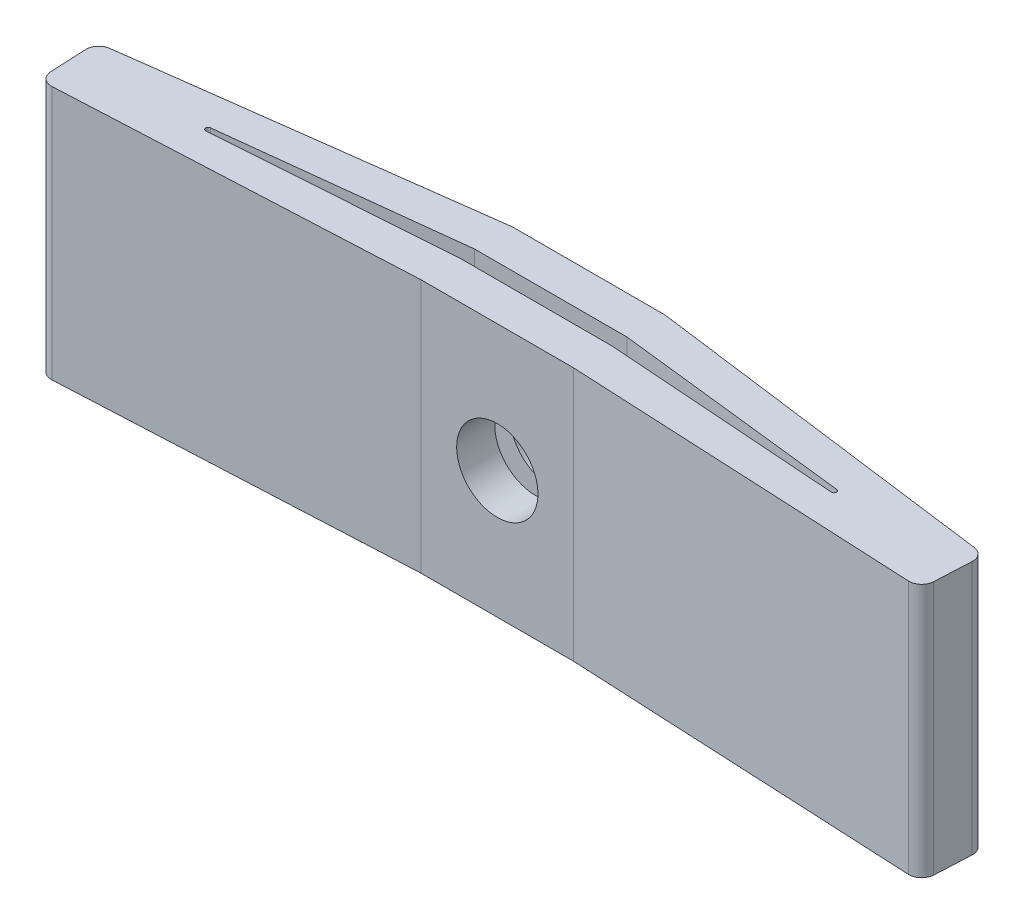
from build123d import *

# Parameters (mm, degrees)
BOSS_EXTRUDE1_DEPTH       = 10
FILLET1_R                 = 0.1
FILLET2_R                 = 0.5
SKETCH2_R                 = 1.6
CUT_EXTRUDE1_DEPTH        = 37.455365189
REVISION_INDICATION_DEPTH = 0.4


with BuildPart() as part:
    # Sketch1 → Boss-Extrude1 (new body)
    with BuildSketch(Plane(origin=(0, 0, 0), x_dir=(1, 0, 0), z_dir=(0, 1, 0))):
        Polygon((20.35, 0.7), (14.35, 0.7), (0, 0), (-0.117073171, 2.4), (14.35, 4.3), (20.35, 4.3), (34.817073171, 2.4), (34.7, 0), align=None)
        Polygon((20.35, 2.2), (14.35, 2.2), (0.35, 1.2), (14.35, 2.8), (20.35, 2.8), (34.35, 1.2), align=None, mode=Mode.SUBTRACT)
    extrude(amount=BOSS_EXTRUDE1_DEPTH)

    # Fillet1
    fillet1_edges = [part.edges().sort_by_distance(p)[0] for p in [
        (0.35, 5, -1.2),
        (34.35, 5, -1.2),
    ]]
    fillet(fillet1_edges, radius=FILLET1_R)

    # Fillet2
    fillet2_edges = [part.edges().sort_by_distance(p)[0] for p in [
        (-0.117073171, 5, -2.4),
        (34.817073171, 5, -2.4),
        (34.7, 5, 0),
        (0, 5, 0),
    ]]
    fillet(fillet2_edges, radius=FILLET2_R)

    # Sketch2 → Cut-Extrude1 (cut, through all)
    with BuildSketch(Plane(origin=(0, 0, -4.3), x_dir=(-1, 0, 0), z_dir=(0, 0, -1))):
        with Locations((-17.35, 5)):
            Circle(SKETCH2_R)
    extrude(amount=-CUT_EXTRUDE1_DEPTH, mode=Mode.SUBTRACT)

    # Sketch5 → revision indication (add)
    with BuildSketch(Plane(origin=(-0.311839138, 0, -2.374420857), x_dir=(-0.9914858429395939, 0, 0.13021452780071538), z_dir=(-0.13021452780071538, 0, -0.9914858429395939))):
        with BuildLine():
            add(Edge.make_bspline(
                [(-1.75614285, 1.976923077), (-1.720782037, 1.974821832), (-1.651461296, 1.970702586), (-1.551241734, 1.942442049), (-1.460537137, 1.892261337), (-1.379742922, 1.825381725), (-1.313146886, 1.744291021), (-1.261177847, 1.654309873), (-1.233163488, 1.553251269), (-1.229074248, 1.483528859), (-1.226976184, 1.44775641)],
                knots=[0, 0, 0, 0, 1.020151414, 1.999887582, 2.974338812, 3.990962822, 5.007586832, 5.987933904, 6.967670073, 8, 8, 8, 8], degree=3))
            add(Edge.make_bspline(
                [(-1.226976184, 1.44775641), (-1.229145345, 1.412843512), (-1.233422899, 1.343995789), (-1.261113631, 1.243699421), (-1.313542951, 1.153662038), (-1.379283581, 1.071471016), (-1.46055711, 1.004449722), (-1.551456175, 0.954695939), (-1.651226029, 0.924411918), (-1.720742787, 0.920554208), (-1.75614285, 0.918589744)],
                knots=[0, 0, 0, 0, 1.009421747, 1.99056486, 2.972319754, 3.999869655, 5.017953583, 5.993804169, 6.978383603, 8, 8, 8, 8], degree=3))
            add(Edge.make_bspline(
                [(-1.75614285, 0.918589744), (-1.791568422, 0.920483127), (-1.860728417, 0.924179507), (-1.960125864, 0.955317742), (-2.051578507, 1.003983162), (-2.132836213, 1.071595984), (-2.19912744, 1.153239101), (-2.249247777, 1.244319503), (-2.279347047, 1.343708683), (-2.283305588, 1.412786963), (-2.285309517, 1.44775641)],
                knots=[0, 0, 0, 0, 1.022052826, 1.995314843, 2.982371812, 4.00089066, 5.028879526, 6.005146991, 6.990147033, 8, 8, 8, 8], degree=3))
            add(Edge.make_bspline(
                [(-2.285309517, 1.44775641), (-2.283382565, 1.483587428), (-2.279620429, 1.553543092), (-2.249184588, 1.653690044), (-2.199516318, 1.744709926), (-2.132377959, 1.825258007), (-2.051598165, 1.892726399), (-1.960346478, 1.941829667), (-1.860489026, 1.970931558), (-1.791528138, 1.974891267), (-1.75614285, 1.976923077)],
                knots=[0, 0, 0, 0, 1.032775665, 2.016367738, 2.991239715, 4.008302682, 5.025365648, 6.011011707, 6.979408107, 8, 8, 8, 8], degree=3))
        make_face()
        with BuildLine():
            add(Edge.make_bspline(
                [(-4.117040286, 1.976923077), (-4.081679473, 1.974821832), (-4.012358732, 1.970702586), (-3.91213917, 1.942442049), (-3.821434573, 1.892261337), (-3.740640358, 1.825381725), (-3.674044322, 1.744291021), (-3.622075283, 1.654309873), (-3.594060924, 1.553251269), (-3.589971684, 1.483528859), (-3.587873619, 1.44775641)],
                knots=[0, 0, 0, 0, 1.020151414, 1.999887582, 2.974338812, 3.990962822, 5.007586832, 5.987933904, 6.967670073, 8, 8, 8, 8], degree=3))
            add(Edge.make_bspline(
                [(-3.587873619, 1.44775641), (-3.590042781, 1.412843512), (-3.594320335, 1.343995789), (-3.622011067, 1.243699421), (-3.674440387, 1.153662038), (-3.740181017, 1.071471016), (-3.821454546, 1.004449722), (-3.91235361, 0.954695939), (-4.012123464, 0.924411918), (-4.081640223, 0.920554208), (-4.117040286, 0.918589744)],
                knots=[0, 0, 0, 0, 1.009421747, 1.99056486, 2.972319754, 3.999869655, 5.017953583, 5.993804169, 6.978383603, 8, 8, 8, 8], degree=3))
            add(Edge.make_bspline(
                [(-4.117040286, 0.918589744), (-4.152465858, 0.920483127), (-4.221625853, 0.924179507), (-4.3210233, 0.955317742), (-4.412475943, 1.003983162), (-4.493733649, 1.071595984), (-4.560024876, 1.153239101), (-4.610145213, 1.244319503), (-4.640244483, 1.343708683), (-4.644203024, 1.412786963), (-4.646206953, 1.44775641)],
                knots=[0, 0, 0, 0, 1.022052826, 1.995314843, 2.982371812, 4.00089066, 5.028879526, 6.005146991, 6.990147033, 8, 8, 8, 8], degree=3))
            add(Edge.make_bspline(
                [(-4.646206953, 1.44775641), (-4.644280001, 1.483587428), (-4.640517865, 1.553543092), (-4.610082024, 1.653690044), (-4.560413754, 1.744709926), (-4.493275395, 1.825258007), (-4.412495601, 1.892726399), (-4.321243914, 1.941829667), (-4.221386462, 1.970931558), (-4.152425574, 1.974891267), (-4.117040286, 1.976923077)],
                knots=[0, 0, 0, 0, 1.032775665, 2.016367738, 2.991239715, 4.008302682, 5.025365648, 6.011011707, 6.979408107, 8, 8, 8, 8], degree=3))
        make_face()
        with BuildLine():
            add(Edge.make_bspline(
                [(-6.477937722, 1.976923077), (-6.442576908, 1.974821832), (-6.373256168, 1.970702586), (-6.273036606, 1.942442049), (-6.182332009, 1.892261337), (-6.101537794, 1.825381725), (-6.034941758, 1.744291021), (-5.982972719, 1.654309873), (-5.95495836, 1.553251269), (-5.95086912, 1.483528859), (-5.948771055, 1.44775641)],
                knots=[0, 0, 0, 0, 1.020151414, 1.999887582, 2.974338812, 3.990962822, 5.007586832, 5.987933904, 6.967670073, 8, 8, 8, 8], degree=3))
            add(Edge.make_bspline(
                [(-5.948771055, 1.44775641), (-5.950940217, 1.412843512), (-5.955217771, 1.343995789), (-5.982908503, 1.243699421), (-6.035337823, 1.153662038), (-6.101078453, 1.071471016), (-6.182351982, 1.004449722), (-6.273251046, 0.954695939), (-6.3730209, 0.924411918), (-6.442537658, 0.920554208), (-6.477937722, 0.918589744)],
                knots=[0, 0, 0, 0, 1.009421747, 1.99056486, 2.972319754, 3.999869655, 5.017953583, 5.993804169, 6.978383603, 8, 8, 8, 8], degree=3))
            add(Edge.make_bspline(
                [(-6.477937722, 0.918589744), (-6.513363294, 0.920483127), (-6.582523289, 0.924179507), (-6.681920736, 0.955317742), (-6.773373379, 1.003983162), (-6.854631085, 1.071595984), (-6.920922312, 1.153239101), (-6.971042649, 1.244319503), (-7.001141919, 1.343708683), (-7.00510046, 1.412786963), (-7.007104389, 1.44775641)],
                knots=[0, 0, 0, 0, 1.022052826, 1.995314843, 2.982371812, 4.00089066, 5.028879526, 6.005146991, 6.990147033, 8, 8, 8, 8], degree=3))
            add(Edge.make_bspline(
                [(-7.007104389, 1.44775641), (-7.005177437, 1.483587428), (-7.001415301, 1.553543092), (-6.97097946, 1.653690044), (-6.92131119, 1.744709926), (-6.85417283, 1.825258007), (-6.773393036, 1.892726399), (-6.68214135, 1.941829667), (-6.582283898, 1.970931558), (-6.51332301, 1.974891267), (-6.477937722, 1.976923077)],
                knots=[0, 0, 0, 0, 1.032775665, 2.016367738, 2.991239715, 4.008302682, 5.025365648, 6.011011707, 6.979408107, 8, 8, 8, 8], degree=3))
        make_face()
    extrude(amount=REVISION_INDICATION_DEPTH)


solid = part.part
